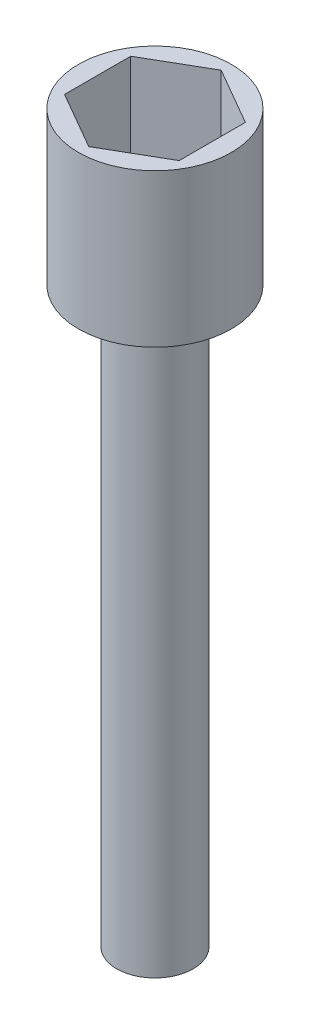
from build123d import *

# Parameters (mm, degrees)
ESQUISSE1_R             = 1
BOSS_EXTRU_1_DEPTH      = 15
ESQUISSE2_R             = 2
BOSS_EXTRU_2_DEPTH      = 4
ENL_V_MAT_EXTRU_1_DEPTH = 3


with BuildPart() as part:
    # Esquisse1 → Boss.-Extru.1 (new body)
    with BuildSketch(Plane(origin=(0, 0, 0), x_dir=(1, 0, 0), z_dir=(0, 1, 0))):
        with Locations(Location((0, 0, 0), (0, 0, 270))):
            Circle(ESQUISSE1_R)
    extrude(amount=BOSS_EXTRU_1_DEPTH)

    # Esquisse2 → Boss.-Extru.2 (add)
    with BuildSketch(Plane(origin=(0, 15, 0), x_dir=(1, 0, 0), z_dir=(0, 1, 0))):
        with Locations(Location((0, 0, 0), (0, 0, 270))):
            Circle(ESQUISSE2_R)
    extrude(amount=BOSS_EXTRU_2_DEPTH)

    # Esquisse3 → Enlèv. mat.-Extru.1 (cut)
    with BuildSketch(Plane(origin=(0, 19, 0), x_dir=(1, 0, 0), z_dir=(0, 1, 0))):
        Polygon((0, 1.732050808), (-1.5, 0.866025404), (-1.5, -0.866025404), (0, -1.732050808), (1.5, -0.866025404), (1.5, 0.866025404), align=None)
    extrude(amount=-ENL_V_MAT_EXTRU_1_DEPTH, mode=Mode.SUBTRACT)


solid = part.part
